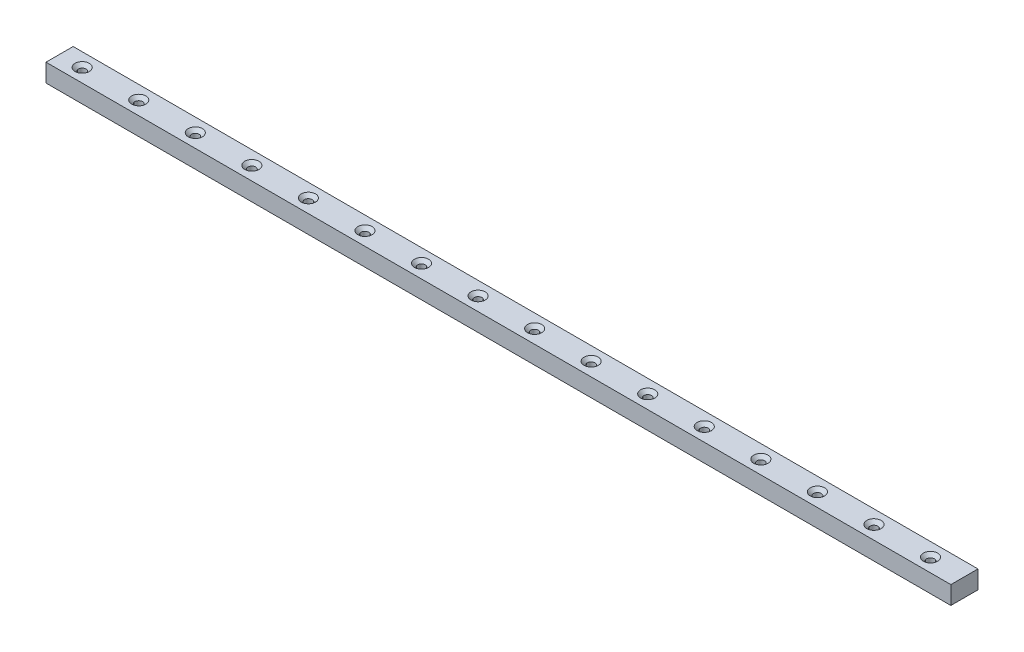
from build123d import *

# Parameters (mm, degrees)
SKETCH1_W                                       = 12
SKETCH1_H                                       = 8
BOSS_EXTRUDE1_DEPTH                             = 400
CSK_FOR_M3_FLAT_HEAD_MACHINE_SCREW1_D           = 3.4
CSK_FOR_M3_FLAT_HEAD_MACHINE_SCREW1_CSINK_D     = 6.3
CSK_FOR_M3_FLAT_HEAD_MACHINE_SCREW1_CSINK_ANGLE = 90
LPATTERN1_COUNT                                 = 16
LPATTERN1_PITCH                                 = 25


with BuildPart() as part:
    # Sketch1 → Boss-Extrude1 (new body)
    with BuildSketch(Plane(origin=(0, 0, 0), x_dir=(0, 0, -1), z_dir=(1, 0, 0))):
        Rectangle(SKETCH1_W, SKETCH1_H)
    extrude(amount=BOSS_EXTRUDE1_DEPTH)

    # CSK for M3 Flat Head Machine Screw1 (through all)
    with Locations(Plane(origin=(0, 4, 0), x_dir=(1, 0, 0), z_dir=(0, 1, 0))):
        with Locations((10, 0)):
            csk_for_m3_flat_head_machine_screw1 = CounterSinkHole(CSK_FOR_M3_FLAT_HEAD_MACHINE_SCREW1_D / 2, CSK_FOR_M3_FLAT_HEAD_MACHINE_SCREW1_CSINK_D / 2, counter_sink_angle=CSK_FOR_M3_FLAT_HEAD_MACHINE_SCREW1_CSINK_ANGLE)

    # LPattern1: CSK for M3 Flat Head Machine Screw1 ×16
    with Locations(*[(i * LPATTERN1_PITCH, 0, 0) for i in range(1, LPATTERN1_COUNT)]):
        add(csk_for_m3_flat_head_machine_screw1, mode=Mode.SUBTRACT)


solid = part.part
